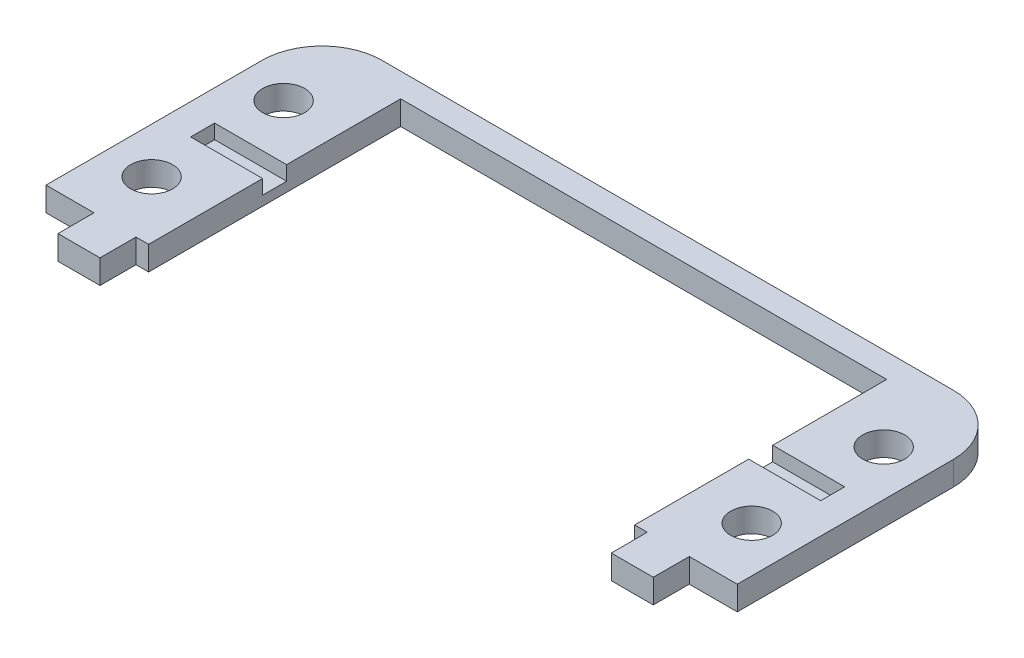
from build123d import *

# Parameters (mm, degrees)
CROQUIS1_R              = 1.75
SALIENTE_EXTRUIR1_DEPTH = 2
CROQUIS2_W              = 6
CROQUIS2_H              = 2
CORTAR_EXTRUIR1_DEPTH   = 1.2


with BuildPart() as part:
    # Croquis1 → Saliente-Extruir1 (new body)
    with BuildSketch(Plane(origin=(0, 0, 0), x_dir=(1, 0, 0), z_dir=(0, 1, 0))):
        with BuildLine():
            Line((-20.25, 0), (-20.25, 21))
            Line((-20.25, 21), (20.25, 21))
            Line((20.25, 21), (20.25, 0))
            Line((20.25, 0), (21.3, 0))
            Line((21.3, 0), (21.3, -3))
            Line((21.3, -3), (24.8, -3))
            Line((24.8, -3), (24.8, 0))
            Line((24.8, 0), (28.8, 0))
            Line((28.8, 0), (28.8, 18))
            ThreePointArc((28.8, 18), (27.335533906, 21.535533906), (23.8, 23))
            Line((23.8, 23), (-23.8, 23))
            ThreePointArc((-23.8, 23), (-27.335533906, 21.535533906), (-28.8, 18))
            Line((-28.8, 18), (-28.8, 0))
            Line((-28.8, 0), (-24.8, 0))
            Line((-24.8, 0), (-24.8, -3))
            Line((-24.8, -3), (-21.3, -3))
            Line((-21.3, -3), (-21.3, 0))
            Line((-21.3, 0), (-20.25, 0))
        make_face()
        with Locations(Location((-25, 5, 0), (0, 0, 270))):
            Circle(CROQUIS1_R, mode=Mode.SUBTRACT)
        with Locations(Location((25, 5, 0), (0, 0, 270))):
            Circle(CROQUIS1_R, mode=Mode.SUBTRACT)
        with Locations(Location((25, 16, 0), (0, 0, 270))):
            Circle(CROQUIS1_R, mode=Mode.SUBTRACT)
        with Locations(Location((-25, 16, 0), (0, 0, 270))):
            Circle(CROQUIS1_R, mode=Mode.SUBTRACT)
    extrude(amount=SALIENTE_EXTRUIR1_DEPTH)

    # Croquis2 → Cortar-Extruir1 (cut)
    with BuildSketch(Plane(origin=(0, 2, 0), x_dir=(1, 0, 0), z_dir=(0, 1, 0))):
        with Locations((-23.25, 10.5)):
            Rectangle(CROQUIS2_W, CROQUIS2_H)
        with Locations((23.25, 10.5)):
            Rectangle(CROQUIS2_W, CROQUIS2_H)
    extrude(amount=-CORTAR_EXTRUIR1_DEPTH, mode=Mode.SUBTRACT)


solid = part.part
